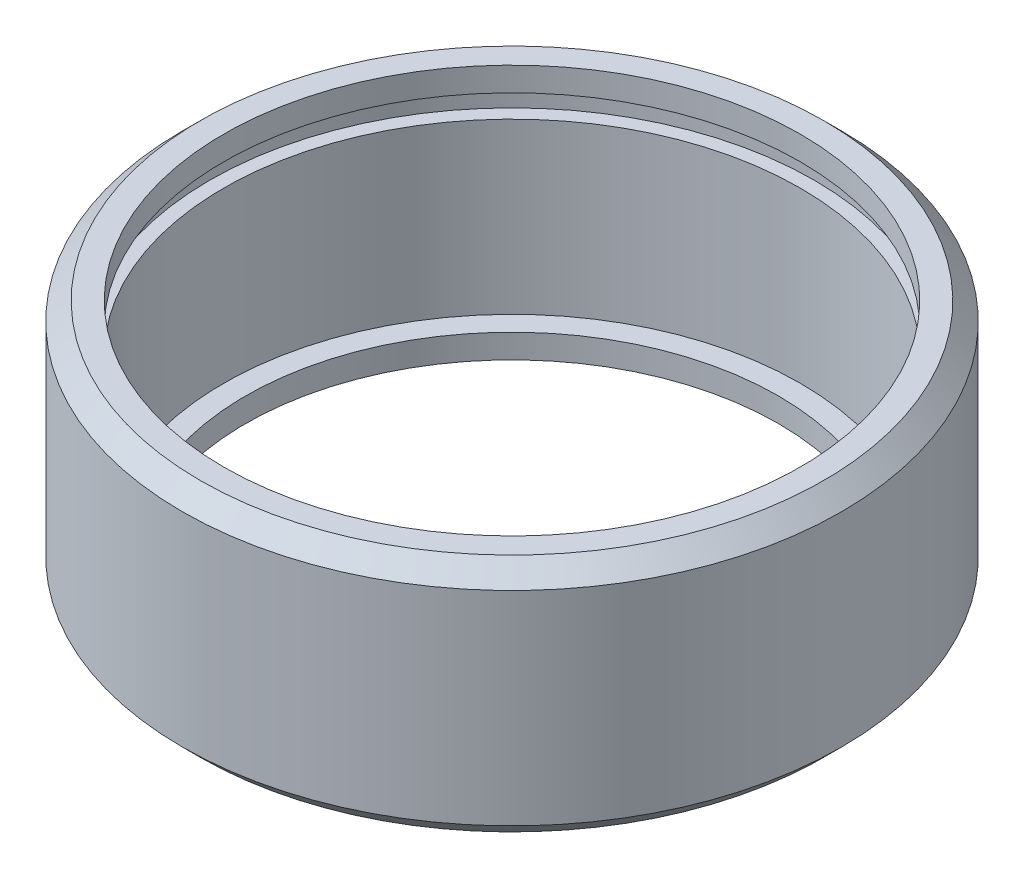
from build123d import *


with BuildPart() as part:
    # Sketch3 → Revolve1 (revolve)
    with BuildSketch(Plane.XY):
        Polygon((11.1125, 0), (11.1125, 1), (12.025, 1), (12.025, 8.05), (12.6, 8.05), (12.6, 9), (12.025, 9), (12.025, 10), (13, 10), (13.75, 9.25), (13.75, 0.75), (13, 0), align=None)
    revolve(axis=Axis((0, 0, 0), (0, 1, 0)))


solid = part.part
